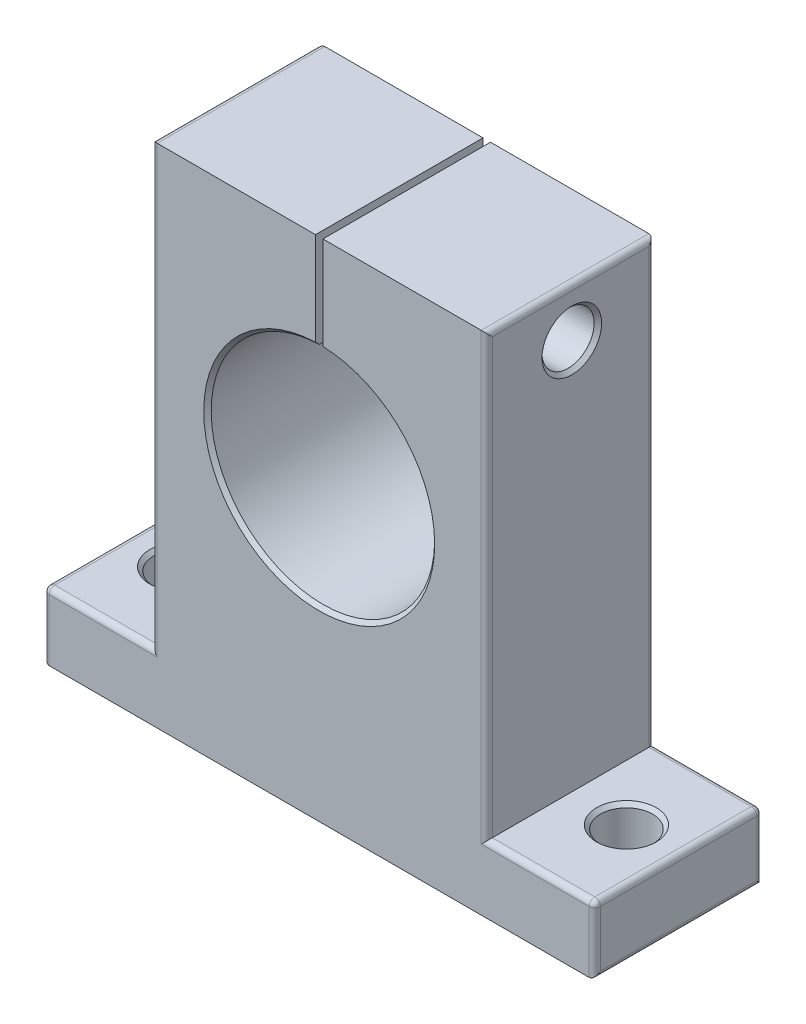
from build123d import *

# Parameters (mm, degrees)
BOSS_EXTRUDE1_DEPTH     = 22.5
SKETCH2_R               = 7
CUT_EXTRUDE1_DEPTH      = 142.089510595
CUT_EXTRUDE2_DEPTH      = 150.198693024
CUT_EXTRUDE2_DEPTH_BACK = 150.198693024
SKETCH5_R               = 7
CHAMFER2_SIZE           = 1
FILLET2_R               = 1.5


with BuildPart() as part:
    # Sketch1 → Boss-Extrude1 (new, symmetric)
    with BuildSketch(Plane.XY):
        with BuildLine():
            Line((-74, -9), (-74, 9))
            Line((-74, 9), (-45, 9))
            Line((-45, 9), (-45, 127))
            Line((-45, 127), (-1, 127))
            Line((-1, 127), (-1, 100.983328701))
            ThreePointArc((-1, 100.983328701), (0, 41), (1, 100.983328701))
            Line((1, 100.983328701), (1, 127))
            Line((1, 127), (45, 127))
            Line((45, 127), (45, 9))
            Line((45, 9), (74, 9))
            Line((74, 9), (74, -9))
            Line((74, -9), (-74, -9))
        make_face()
    extrude(amount=BOSS_EXTRUDE1_DEPTH, both=True)

    # Sketch2 → Cut-Extrude1 (cut, through all)
    with BuildSketch(Plane(origin=(0, 9, 0), x_dir=(1, 0, 0), z_dir=(0, 1, 0))):
        with Locations(Location((60, 0, 0), (0, 0, 180))):
            Circle(SKETCH2_R)
        with Locations((-60, 0)):
            Circle(SKETCH2_R)
    extrude(amount=-CUT_EXTRUDE1_DEPTH, mode=Mode.SUBTRACT)

    # Sketch5 → Cut-Extrude2 (cut, two sides: drawn at the far end of the back side and taken through both)
    with BuildSketch(Plane(origin=(-1, 0, 0), x_dir=(0, 0, -1), z_dir=(1, 0, 0)).offset(-CUT_EXTRUDE2_DEPTH_BACK)):
        with Locations(Location((0.330734984, 113.991664351, 0), (0, 0, 90))):
            Circle(SKETCH5_R)
    extrude(amount=CUT_EXTRUDE2_DEPTH + CUT_EXTRUDE2_DEPTH_BACK, mode=Mode.SUBTRACT)

    # Chamfer2
    chamfer2_edges = [part.edges().sort_by_distance(p)[0] for p in [
        (0, 41, -22.5),
        (0, 41, 22.5),
        (67, 9, 0),
        (-67, 9, 0),
        (-45, 106.991664351, -0.330734984),
        (45, 106.991664351, -0.330734984),
    ]]
    chamfer(chamfer2_edges, length=CHAMFER2_SIZE)

    # Fillet2
    fillet2_edges = [part.edges().sort_by_distance(p)[0] for p in [
        (-59.5, 9, 22.5),
        (45, 68, -22.5),
        (59.5, 9, -22.5),
        (-74, 0, 22.5),
        (74, 0, -22.5),
        (-74, 0, -22.5),
        (-59.5, 9, -22.5),
        (-45, 68, -22.5),
        (74, 0, 22.5),
        (45, 127, 0),
        (74, 9, 0),
        (74, -9, 0),
        (-74, -9, 0),
        (-74, 9, 0),
        (-45, 127, 0),
        (59.5, 9, 22.5),
        (45, 68, 22.5),
        (-45, 68, 22.5),
    ]]
    fillet(fillet2_edges, radius=FILLET2_R)


solid = part.part
